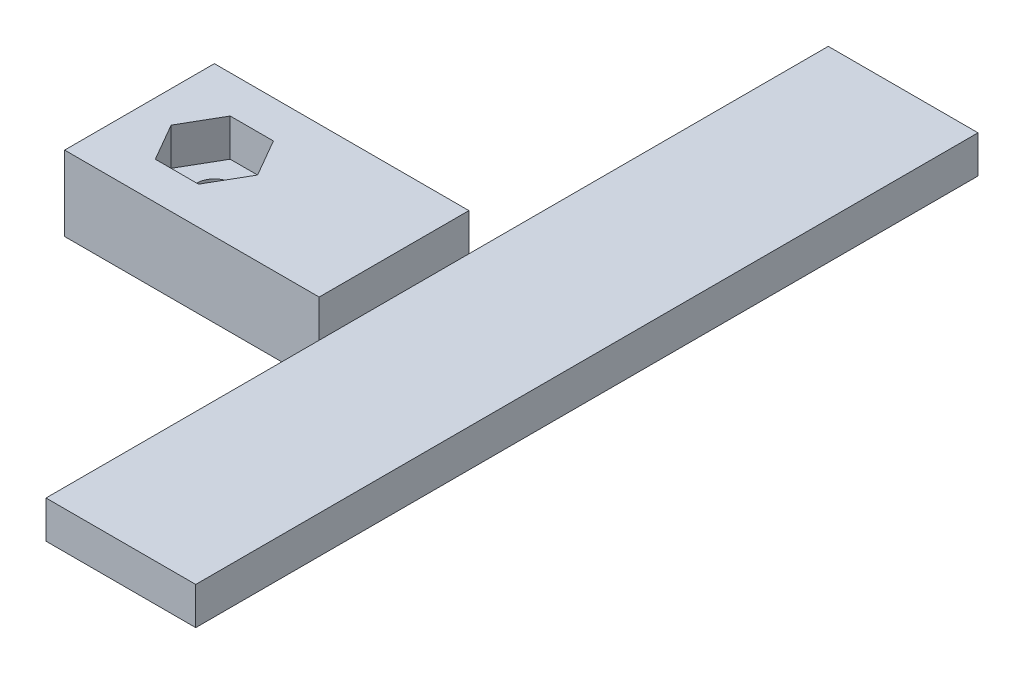
from build123d import *

# Parameters (mm, degrees)
SKETCH1_W           = 21.59
SKETCH1_H           = 12.7
BOSS_EXTRUDE3_DEPTH = 3.175
SKETCH1_5_R         = 1.5
BOSS_EXTRUDE4_DEPTH = 3.175


with BuildPart() as part:
    # Sketch1 → Boss-Extrude3 (new body)
    with BuildSketch(Plane(origin=(0, 0, 0), x_dir=(1, 0, 0), z_dir=(0, 1, 0))):
        with Locations((-6.35, 0)):
            Rectangle(SKETCH1_W, SKETCH1_H)
        Polygon((-7.128825791, 0), (-8.961912895, -3.175), (-12.628087105, -3.175), (-14.461174209, 0), (-12.628087105, 3.175), (-8.961912895, 3.175), align=None, mode=Mode.SUBTRACT)
    extrude(amount=BOSS_EXTRUDE3_DEPTH)

    # Sketch1<5> → Boss-Extrude4 (add)
    with BuildSketch(Plane(origin=(0, 0, 0), x_dir=(1, 0, 0), z_dir=(0, 1, 0))):
        Polygon((17.145, -29.52), (17.145, 36.83), (4.445, 36.83), (4.445, 6.35), (-17.145, 6.35), (-17.145, -6.35), (4.445, -6.35), (4.445, -29.52), align=None)
        with Locations((-10.795, 0)):
            Circle(SKETCH1_5_R, mode=Mode.SUBTRACT)
    extrude(amount=-BOSS_EXTRUDE4_DEPTH)


solid = part.part
